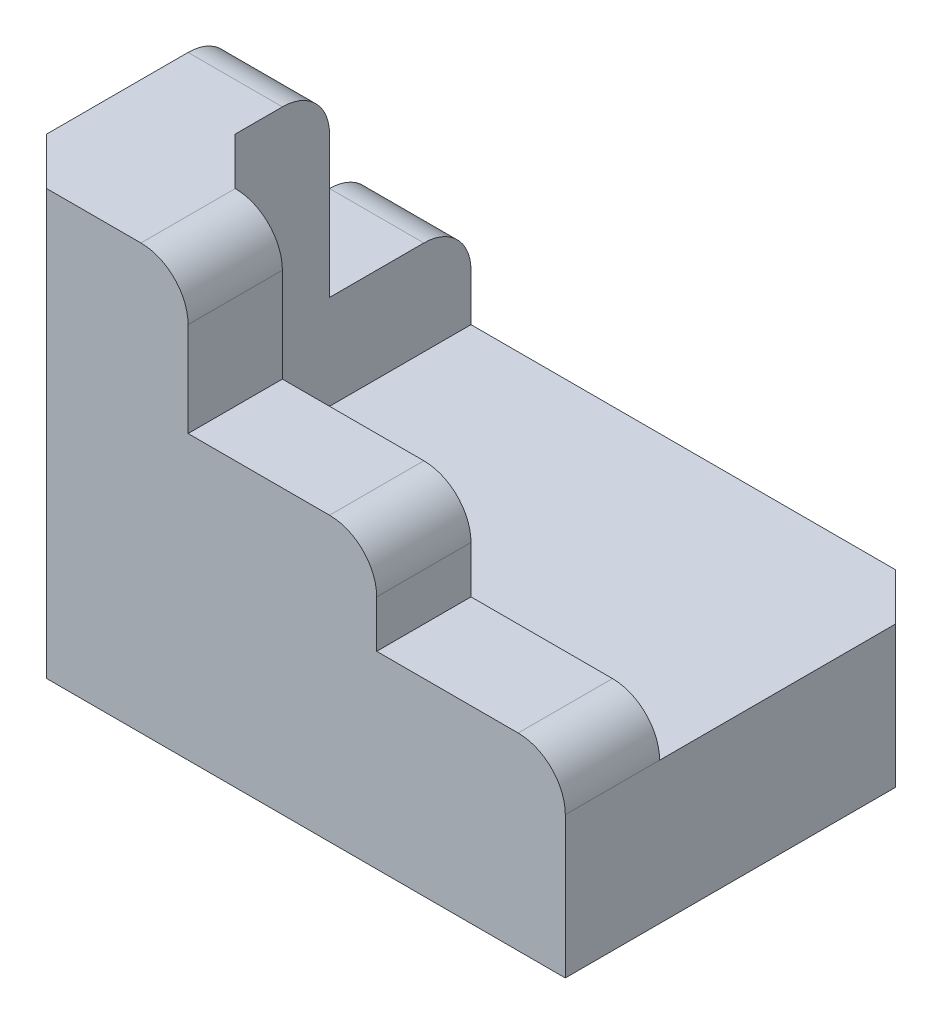
from build123d import *

# Parameters (mm, degrees)
SKETCH1_W           = 60
SKETCH1_H           = 40
BOSS_EXTRUDE1_DEPTH = 45
CUT_EXTRUDE1_START  = 45
SKETCH1_3_W         = 50
SKETCH1_3_H         = 30
CUT_EXTRUDE1_DEPTH  = 30
SKETCH2_W           = 40
SKETCH2_H           = 15
SKETCH2_W_2         = 20
SKETCH2_H_2         = 10
CUT_EXTRUDE2_DEPTH  = 30
SKETCH3_W           = 15
SKETCH3_H           = 20
CUT_EXTRUDE3_DEPTH  = 30
FILLET1_R           = 5
CHAMFER2_SIZE       = 5


with BuildPart() as part:
    # Sketch1 → Boss-Extrude1 (new body)
    with BuildSketch(Plane(origin=(0, 0, 0), x_dir=(1, 0, 0), z_dir=(0, 1, 0))):
        with Locations((30, 20)):
            Rectangle(SKETCH1_W, SKETCH1_H)
    extrude(amount=BOSS_EXTRUDE1_DEPTH)

    # Sketch1<3> → Cut-Extrude1 (cut)
    with BuildSketch(Plane(origin=(0, 0, 0), x_dir=(1, 0, 0), z_dir=(0, 1, 0)).offset(CUT_EXTRUDE1_START)):
        with Locations((35, 25)):
            Rectangle(SKETCH1_3_W, SKETCH1_3_H)
    extrude(amount=-CUT_EXTRUDE1_DEPTH, mode=Mode.SUBTRACT)

    # Sketch2 → Cut-Extrude2 (cut)
    with BuildSketch(Plane.XY):
        with Locations((40, 37.5)):
            Rectangle(SKETCH2_W, SKETCH2_H)
        with Locations((50, 25)):
            Rectangle(SKETCH2_W_2, SKETCH2_H_2)
    extrude(amount=-CUT_EXTRUDE2_DEPTH, mode=Mode.SUBTRACT)

    # Sketch3 → Cut-Extrude3 (cut)
    with BuildSketch(Plane(origin=(0, 0, 0), x_dir=(0, 0, -1), z_dir=(1, 0, 0))):
        with Locations((32.5, 35)):
            Rectangle(SKETCH3_W, SKETCH3_H)
    extrude(amount=CUT_EXTRUDE3_DEPTH, mode=Mode.SUBTRACT)

    # Fillet1
    fillet1_edges = [part.edges().sort_by_distance(p)[0] for p in [
        (5, 25, -40),
        (5, 45, -25),
        (20, 45, -5),
        (40, 30, -5),
        (60, 20, -5),
    ]]
    fillet(fillet1_edges, radius=FILLET1_R)

    # Chamfer2
    chamfer2_edges = [part.edges().sort_by_distance(p)[0] for p in [
        (10, 30, -10),
        (60, 7.5, -40),
        (0, 22.5, 0),
    ]]
    chamfer(chamfer2_edges, length=CHAMFER2_SIZE)


solid = part.part
